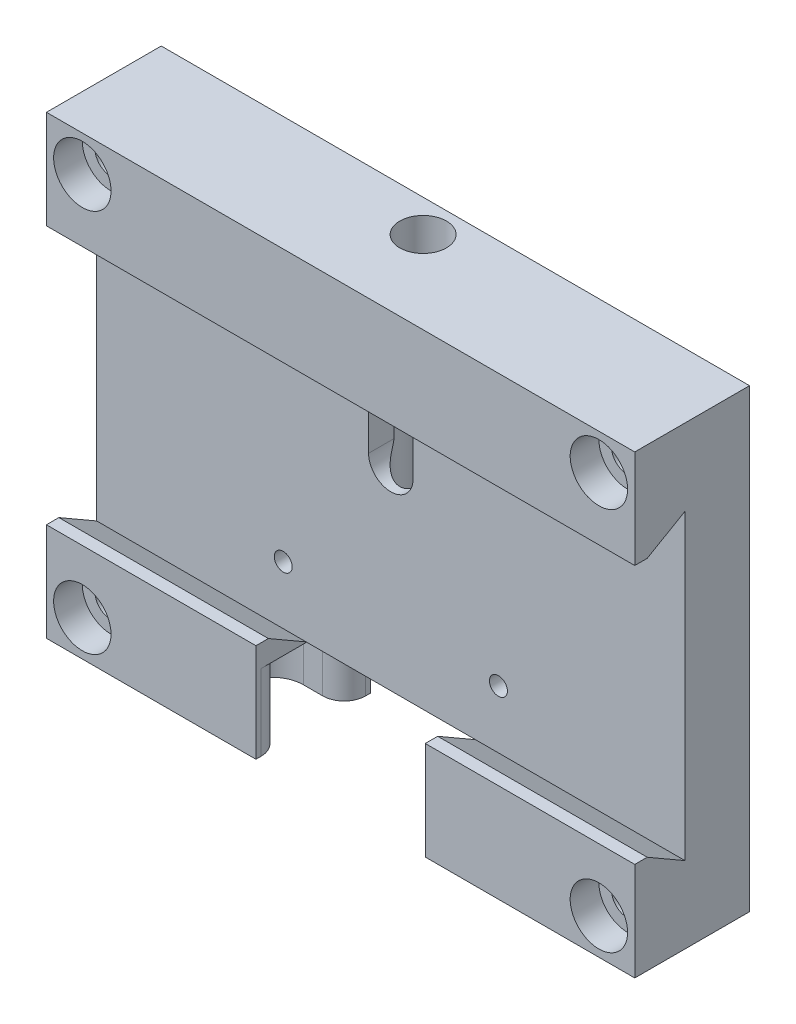
from build123d import *
from OCP.BRepFilletAPI import BRepFilletAPI_MakeChamfer

# Parameters (mm, degrees)
SKETCH_1_W                  = 82
SKETCH_1_H                  = 63.5
EXTRUDE_1_DEPTH             = 16
CUT_EXTRUDE_1_DEPTH         = 105.939268151
SKETCH_15_W                 = 23.6
SKETCH_15_H                 = 14.711451884
CUT_EXTRUDE_4_DEPTH         = 7
SKETCH_16_W                 = 23.6
SKETCH_16_H                 = 10.67
CUT_EXTRUDE_5_DEPTH         = 9
SKETCH_17_R                 = 2.5
CUT_EXTRUDE_6_DEPTH         = 8
M4X0_72_D                   = 3.3
M4X0_72_DEPTH               = 10
M4X0_72_TIP                 = 0.991420021
CUT_EXTRUDE_7_DEPTH         = 4
SKETCH_26_R                 = 3.25
CUT_EXTRUDE_8_DEPTH         = 38
HOLE_WIZARD_M41_D           = 4.5
HOLE_WIZARD_M41_CBORE_D     = 8
HOLE_WIZARD_M41_CBORE_DEPTH = 4
CHAMFER_2_SIZE              = 1
CHAMFER_2_SIZE2             = 2
CUT_EXTRUDE_12_DEPTH        = 10.6
FILLET_1_R                  = 3
M3X0_51_D                   = 2.5


with BuildPart() as part:
    # Эскиз1 → Бобышка-Вытянуть1 (new body)
    with BuildSketch(Plane.XY):
        with Locations((41, -31.75)):
            Rectangle(SKETCH_1_W, SKETCH_1_H)
    extrude(amount=EXTRUDE_1_DEPTH)

    # Эскиз2 → Вырез-Вытянуть1 (cut, through all)
    with BuildSketch(Plane.ZY):
        Polygon((9, -10.67), (16, -14.711451884), (16, -48.788548116), (9, -52.83), align=None)
    extrude(amount=-CUT_EXTRUDE_1_DEPTH, mode=Mode.SUBTRACT)

    # Эскиз15 → Вырез-Вытянуть4 (cut)
    with BuildSketch(Plane.XY.offset(16)):
        with Locations((41, -56.144274058)):
            Rectangle(SKETCH_15_W, SKETCH_15_H)
    extrude(amount=-CUT_EXTRUDE_4_DEPTH, mode=Mode.SUBTRACT)

    # Эскиз16 → Вырез-Вытянуть5 (cut)
    with BuildSketch(Plane.XY.offset(9)):
        with Locations((41, -58.165)):
            Rectangle(SKETCH_16_W, SKETCH_16_H)
    extrude(amount=-CUT_EXTRUDE_5_DEPTH, mode=Mode.SUBTRACT)

    # Эскиз17 → Вырез-Вытянуть6 (cut)
    with BuildSketch(Plane.XZ.offset(52.83)):
        with Locations(Location((33.5, 5, 0), (0, 0, 270))):
            Circle(SKETCH_17_R)
        with Locations(Location((48.5, 5, 0), (0, 0, 90))):
            Circle(SKETCH_17_R)
    extrude(amount=-CUT_EXTRUDE_6_DEPTH, mode=Mode.SUBTRACT)

    # Отверстие обработанное метчиком M4x0.72
    with Locations(Plane(origin=(0, -52.83, 0), x_dir=(-1, 0, 0), z_dir=(0, -1, 0))):
        with Locations((-41, -5)):
            Hole(M4X0_72_D / 2, depth=M4X0_72_DEPTH)
            with Locations((0, 0, -(M4X0_72_DEPTH + M4X0_72_TIP / 2))):  # 118° drill point
                Cone(0, M4X0_72_D / 2, M4X0_72_TIP, mode=Mode.SUBTRACT)

    # Эскиз25 → Вырез-Вытянуть7 (cut)
    with BuildSketch(Plane.XY.offset(9)):
        with BuildLine():
            Line((44.1, -18.711451884), (44.1, -25.711451884))
            ThreePointArc((44.1, -25.711451884), (41, -28.811451884), (37.9, -25.711451884))
            Line((37.9, -25.711451884), (37.9, -18.711451884))
            ThreePointArc((37.9, -18.711451884), (41, -15.611451884), (44.1, -18.711451884))
        make_face()
    extrude(amount=-CUT_EXTRUDE_7_DEPTH, mode=Mode.SUBTRACT)

    # Эскиз26 → Вырез-Вытянуть8 (cut)
    with BuildSketch(Plane(origin=(0, 0, 0), x_dir=(1, 0, 0), z_dir=(0, 1, 0))):
        with Locations(Location((41, -4.5, 0), (0, 0, 270))):
            Circle(SKETCH_26_R)
    extrude(amount=-CUT_EXTRUDE_8_DEPTH, mode=Mode.SUBTRACT)

    # Цековка для винта с внутренним шестигранником M41 (through all)
    with Locations(Plane(origin=(30.759227947, 26.793365177, 16), x_dir=(-1, 0, 0), z_dir=(0, 0, 1))):
        with Locations((-46.240772053, 31.793365177), (-46.240772053, 85.293365177), (25.759227947, 85.293365177), (25.759227947, 31.793365177)):
            CounterBoreHole(HOLE_WIZARD_M41_D / 2, HOLE_WIZARD_M41_CBORE_D / 2, HOLE_WIZARD_M41_CBORE_DEPTH)

    # Фаска2: one chamfer whose edges measure the first distance from different faces: ONE call of the kernel's chamfer builder (chamfer() names one face for all edges)
    chamfer_2_edges_1 = [part.edges().sort_by_distance(p)[0] for p in [
        (41, -14.711451884, 16),
    ]]
    chamfer_2_side_1 = [part.faces().sort_by_distance(p)[0] for p in [
        (41, -7.569889145, 16),
    ]]
    chamfer_2_edges_2 = [part.edges().sort_by_distance(p)[0] for p in [
        (67.4, -48.788548116, 16),
    ]]
    chamfer_2_side_2 = [part.faces().sort_by_distance(p)[0] for p in [
        (66.127821531, -55.832096576, 16),
    ]]
    chamfer_2_edges_3 = [part.edges().sort_by_distance(p)[0] for p in [
        (14.6, -48.788548116, 16),
    ]]
    chamfer_2_side_3 = [part.faces().sort_by_distance(p)[0] for p in [
        (15.872178469, -55.832096576, 16),
    ]]
    chamfer_2 = BRepFilletAPI_MakeChamfer(part.part.solid().wrapped)
    for e in chamfer_2_edges_1:
        chamfer_2.Add(CHAMFER_2_SIZE, CHAMFER_2_SIZE2, e.wrapped, chamfer_2_side_1[0].wrapped)  # the first distance lies on this face
    for e in chamfer_2_edges_2:
        chamfer_2.Add(CHAMFER_2_SIZE, CHAMFER_2_SIZE2, e.wrapped, chamfer_2_side_2[0].wrapped)  # the first distance lies on this face
    for e in chamfer_2_edges_3:
        chamfer_2.Add(CHAMFER_2_SIZE, CHAMFER_2_SIZE2, e.wrapped, chamfer_2_side_3[0].wrapped)  # the first distance lies on this face
    add(Compound.cast(chamfer_2.Shape()), mode=Mode.REPLACE)

    # Эскиз32 → Вырез-Вытянуть12 (cut)
    with BuildSketch(Plane.XZ.offset(63.5)):
        with BuildLine():
            Line((52.7, -0.2), (52.7, 3.7))
            Line((52.7, 3.7), (58.5, 3.7))
            ThreePointArc((58.5, 3.7), (62.8, 8), (58.5, 12.3))
            Line((58.5, 12.3), (52.7, 12.3))
            Line((52.7, 12.3), (52.7, 16.2))
            Line((52.7, 16.2), (29.3, 16.2))
            Line((29.3, 16.2), (29.3, 12.3))
            Line((29.3, 12.3), (23.5, 12.3))
            ThreePointArc((23.5, 12.3), (19.2, 8), (23.5, 3.7))
            Line((23.5, 3.7), (29.3, 3.7))
            Line((29.3, 3.7), (29.3, -0.2))
            Line((29.3, -0.2), (52.7, -0.2))
        make_face()
    extrude(amount=-CUT_EXTRUDE_12_DEPTH, mode=Mode.SUBTRACT)

    # Скругление1
    fillet_1_edges = [part.edges().sort_by_distance(p)[0] for p in [
        (52.8, -58.2, 3.7),
        (52.8, -58.2, 12.3),
        (29.2, -58.2, 12.3),
        (29.2, -58.2, 3.7),
    ]]
    fillet(fillet_1_edges, radius=FILLET_1_R)

    # Отверстие обработанное метчиком M3x0.51 (through all)
    with Locations(Plane(origin=(0, 0, 0), x_dir=(-1, 0, 0), z_dir=(0, 0, -1))):
        with Locations((-26, -44.75), (-26, -18.75), (-56, -18.75), (-56, -44.75)):
            Hole(M3X0_51_D / 2)


solid = part.part
